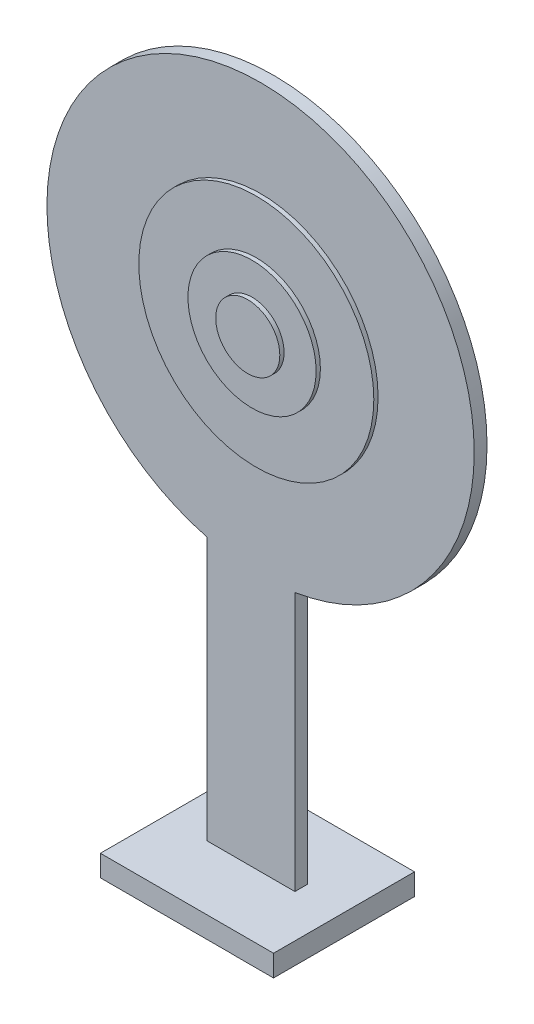
from build123d import *

# Parameters (mm, degrees)
SKETCH_2_R       = 50
EXTRUDE_1_DEPTH  = 3
SKETCH_3_R       = 27.5
EXTRUDE_2_DEPTH  = 1
SKETCH_4_R       = 15
EXTRUDE_3_DEPTH  = 1
SKETCH_5_R       = 7.5
EXTRUDE_4_DEPTH  = 1
EXTRUDE_5_DEPTH  = 3
SKETCH_16_W      = 15
SKETCH_16_H      = 5
EXTRUDE_7_DEPTH  = 20.52
SKETCH_18_W      = 15
SKETCH_18_H      = 5
EXTRUDE_9_DEPTH  = 20.55
SKETCH_19_W      = 33
SKETCH_19_H      = 5.022974077
EXTRUDE_10_DEPTH = 10
SKETCH_20_W      = 33
SKETCH_20_H      = 4.984152866
EXTRUDE_11_DEPTH = 10


with BuildPart() as part:
    # 草图2 → 凸台-拉伸1 (new body)
    with BuildSketch(Plane.XY):
        Circle(SKETCH_2_R)
    extrude(amount=EXTRUDE_1_DEPTH)

    # 草图3 → 凸台-拉伸2 (add)
    with BuildSketch(Plane.XY.offset(3)):
        Circle(SKETCH_3_R)
    extrude(amount=EXTRUDE_2_DEPTH)

    # 草图4 → 凸台-拉伸3 (add)
    with BuildSketch(Plane.XY.offset(4)):
        Circle(SKETCH_4_R)
    extrude(amount=EXTRUDE_3_DEPTH)

    # 草图5 → 凸台-拉伸4 (add)
    with BuildSketch(Plane.XY.offset(5)):
        Circle(SKETCH_5_R)
    extrude(amount=EXTRUDE_4_DEPTH)

    # 草图6 → 凸台-拉伸5 (add)
    with BuildSketch(Plane.XY):
        with BuildLine():
            Line((-12.491130148, -48.414581147), (-12.491130148, -114.964581147))
            Line((-12.491130148, -114.964581147), (8.028142932, -114.964581147))
            Line((8.028142932, -114.964581147), (8.028142932, -49.351280845))
            ThreePointArc((8.028142932, -49.351280845), (-2.280113003, -49.94798379), (-12.491130148, -48.414581147))
        make_face()
    extrude(amount=EXTRUDE_5_DEPTH)

    # 草图16 → 凸台-拉伸7 (add)
    with BuildSketch(Plane(origin=(8.028142932, 0, 0), x_dir=(0, 0, -1), z_dir=(1, 0, 0))):
        with Locations((7.5, -112.464581147)):
            Rectangle(SKETCH_16_W, SKETCH_16_H)
    extrude(amount=-EXTRUDE_7_DEPTH)

    # 草图18 → 凸台-拉伸9 (add)
    with BuildSketch(Plane(origin=(8.028142932, 0, 0), x_dir=(0, 0, -1), z_dir=(1, 0, 0))):
        with Locations((-10.5, -112.464581147)):
            Rectangle(SKETCH_18_W, SKETCH_18_H)
    extrude(amount=-EXTRUDE_9_DEPTH)

    # 草图19 → 凸台-拉伸10 (add)
    with BuildSketch(Plane(origin=(8.028142932, 0, 0), x_dir=(0, 0, -1), z_dir=(1, 0, 0))):
        with Locations((-1.5, -112.476068185)):
            Rectangle(SKETCH_19_W, SKETCH_19_H)
    extrude(amount=EXTRUDE_10_DEPTH)

    # 草图20 → 凸台-拉伸11 (add)
    with BuildSketch(Plane.ZY.offset(12.491857068)):
        with Locations((1.5, -112.45665758)):
            Rectangle(SKETCH_20_W, SKETCH_20_H)
    extrude(amount=EXTRUDE_11_DEPTH)


solid = part.part
